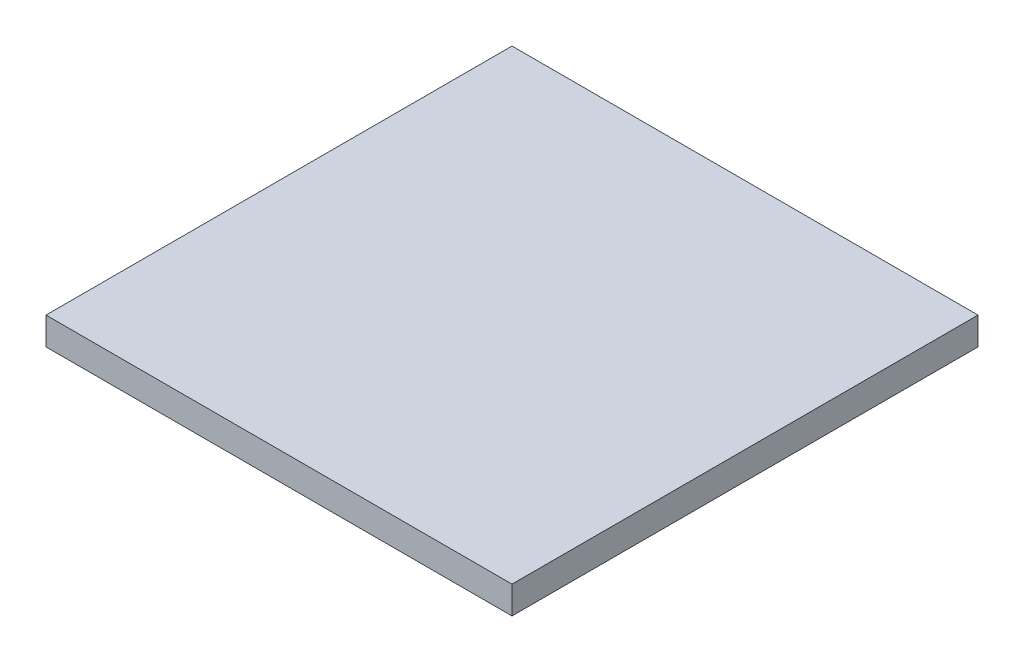
from build123d import *

# Parameters (mm, degrees)
SKETCH1_W           = 1625.6
SKETCH1_H           = 96.23552
BOSS_EXTRUDE1_DEPTH = 1625.6


with BuildPart() as part:
    # Sketch1 → Boss-Extrude1 (new body)
    with BuildSketch(Plane.XY):
        Rectangle(SKETCH1_W, SKETCH1_H)
    extrude(amount=BOSS_EXTRUDE1_DEPTH)


solid = part.part
